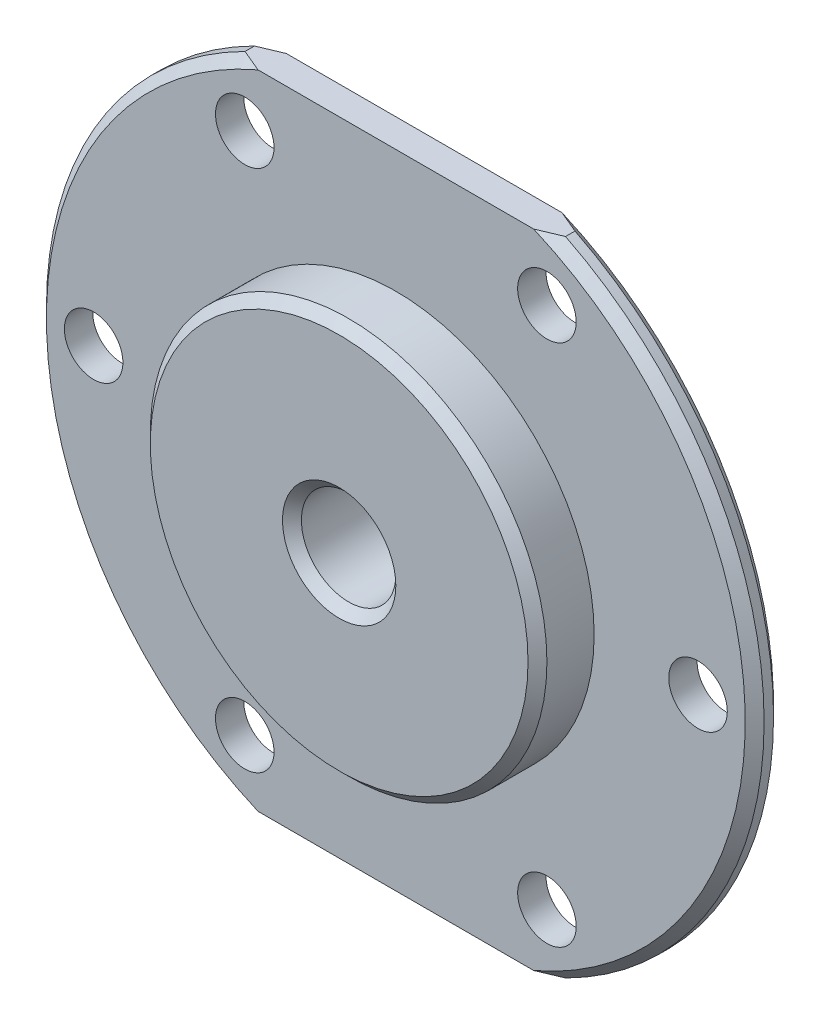
from build123d import *

# Parameters (mm, degrees)
SKETCH2_R           = 1.55
BOSS_EXTRUDE1_DEPTH = 1.5
SKETCH3_R           = 10.5
BOSS_EXTRUDE2_DEPTH = 3
SKETCH4_R           = 5
BOSS_EXTRUDE3_DEPTH = 5
SKETCH5_R           = 2.5
CUT_EXTRUDE1_DEPTH  = 28.207535721
CHAMFER1_SIZE       = 0.5


with BuildPart() as part:
    # Sketch2 → Boss-Extrude1 (new body)
    with BuildSketch(Plane.XY):
        with BuildLine():
            Line((-8.485281374, 17), (8.485281374, 17))
            ThreePointArc((8.485281374, 17), (19, 0), (8.485281374, -17))
            Line((8.485281374, -17), (-8.485281374, -17))
            ThreePointArc((-8.485281374, -17), (-19, 0), (-8.485281374, 17))
        make_face()
        with Locations((-16, 0)):
            Circle(SKETCH2_R, mode=Mode.SUBTRACT)
        with Locations((-8, 13.856406461)):
            Circle(SKETCH2_R, mode=Mode.SUBTRACT)
        with Locations((8, 13.856406461)):
            Circle(SKETCH2_R, mode=Mode.SUBTRACT)
        with Locations((16, 0)):
            Circle(SKETCH2_R, mode=Mode.SUBTRACT)
        with Locations((8, -13.856406461)):
            Circle(SKETCH2_R, mode=Mode.SUBTRACT)
        with Locations((-8, -13.856406461)):
            Circle(SKETCH2_R, mode=Mode.SUBTRACT)
    extrude(amount=BOSS_EXTRUDE1_DEPTH)

    # Sketch3 → Boss-Extrude2 (add)
    with BuildSketch(Plane.XY.offset(1.5)):
        Circle(SKETCH3_R)
    extrude(amount=BOSS_EXTRUDE2_DEPTH)

    # Sketch4 → Boss-Extrude3 (add)
    with BuildSketch(Plane(origin=(0, 0, 0), x_dir=(-1, 0, 0), z_dir=(0, 0, -1))):
        Circle(SKETCH4_R)
    extrude(amount=BOSS_EXTRUDE3_DEPTH)

    # Sketch5 → Cut-Extrude1 (cut, through all)
    with BuildSketch(Plane.XY.offset(4.5)):
        Circle(SKETCH5_R)
    extrude(amount=-CUT_EXTRUDE1_DEPTH, mode=Mode.SUBTRACT)

    # Chamfer1
    chamfer1_edges = [part.edges().sort_by_distance(p)[0] for p in [
        (-19, 0, 1.5),
        (-10.5, 0, 4.5),
        (5, 0, -5),
        (19, 0, 1.5),
        (-2.5, 0, -5),
        (-2.5, 0, 4.5),
        (-19, 0, 0),
        (19, 0, 0),
    ]]
    chamfer(chamfer1_edges, length=CHAMFER1_SIZE)


solid = part.part
